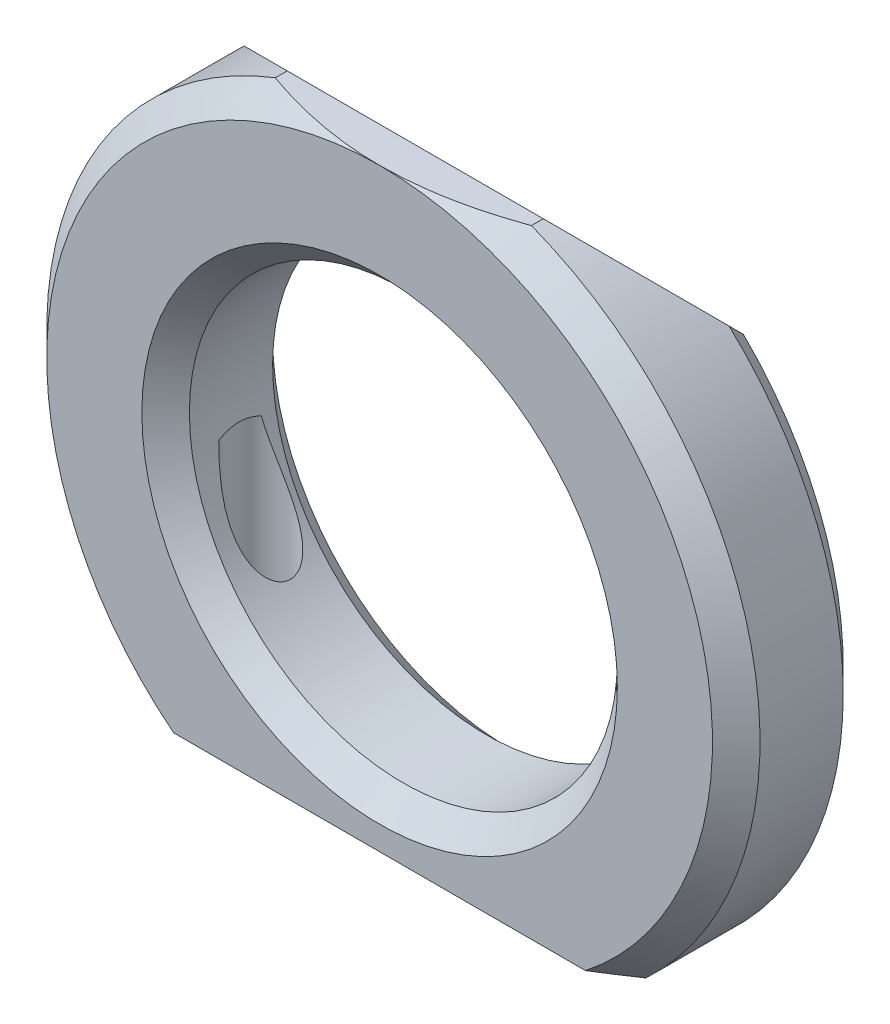
from build123d import *

# Parameters (mm, degrees)
SKETCH_1_R             = 7
SKETCH_1_R_2           = 5.5
EXTRUDE_1_DEPTH        = 30
EXTRUDE_START          = -7
SKETCH_2_R             = 15
SKETCH_2_R_2           = 5.5
EXTRUDE_2_DEPTH        = 7
SKETCH_5_W             = 5.5
SKETCH_5_H             = 9
CUT_EXTRUDE_4_DEPTH    = 15
HOLE_WIZARD_M3_1_D     = 2.5
HOLE_WIZARD_M3_1_DEPTH = 9.5
HOLE_WIZARD_M3_1_TIP   = 0.751075774
FILLET_1_R             = 1
SKETCH1_R              = 7.5
EXTRUDE1_DEPTH         = 5
CHAMFER1_SIZE          = 1
SKETCH_9_R             = 18
CUT_EXTRUDE_1_DEPTH    = 55
SKETCH_10_R            = 9
CUT_EXTRUDE_2_DEPTH    = 22.914607001
CHAMFER_5_SIZE         = 1
SKETCH_12_OUTSIDE_W    = 15.516
SKETCH_12_OUTSIDE_H    = 36.016
CUT_EXTRUDE_4_2_DEPTH  = 15


with BuildPart() as part:
    # 草图1 → 拉伸1 (new, symmetric)
    with BuildSketch(Plane.XY):
        Circle(SKETCH_1_R)
        Circle(SKETCH_1_R_2, mode=Mode.SUBTRACT)
    extrude(amount=EXTRUDE_1_DEPTH, both=True)

    # 草图2 → 拉伸2 (add)
    with BuildSketch(Plane.XY.offset(30).offset(EXTRUDE_START)):
        Circle(SKETCH_2_R)
        Circle(SKETCH_2_R_2, mode=Mode.SUBTRACT)
    extrude_2 = extrude(amount=EXTRUDE_2_DEPTH)

    # 镜向1: 拉伸2 across plane
    add(extrude_2.mirror(Plane.XY))

    # 草图5 → Cut-Extrude 4 (cut, symmetric)
    with BuildSketch(Plane(origin=(0, 0, 0), x_dir=(0, 0, -1), z_dir=(1, 0, 0))):
        with Locations((-27.25, -15.5)):
            Rectangle(SKETCH_5_W, SKETCH_5_H)
        with Locations((27.25, -15.5)):
            Rectangle(SKETCH_5_W, SKETCH_5_H)
    extrude(amount=CUT_EXTRUDE_4_DEPTH, both=True, mode=Mode.SUBTRACT)

    # M3 螺纹孔1
    with Locations(Plane(origin=(-8, -11, 27.5), x_dir=(0, 0, -1), z_dir=(0, -1, 0))):
        with Locations((0, 0), (0, 16), (55, 0), (55, 16)):
            Hole(HOLE_WIZARD_M3_1_D / 2, depth=HOLE_WIZARD_M3_1_DEPTH)
            with Locations((0, 0, -(HOLE_WIZARD_M3_1_DEPTH + HOLE_WIZARD_M3_1_TIP / 2))):  # 118° drill point
                Cone(0, HOLE_WIZARD_M3_1_D / 2, HOLE_WIZARD_M3_1_TIP, mode=Mode.SUBTRACT)

    # 圆角1
    fillet_1_edges = [part.edges().sort_by_distance(p)[0] for p in [
        (-7, 0, -23),
        (-7, 0, 23),
    ]]
    fillet(fillet_1_edges, radius=FILLET_1_R)

    # Sketch1 → Extrude1 (cut)
    with BuildSketch(Plane(origin=(0, 0, 30), x_dir=(-1, 0, 0), z_dir=(0, 0, -1))):
        Circle(SKETCH1_R)
    extrude(amount=EXTRUDE1_DEPTH, mode=Mode.SUBTRACT)

    # Chamfer1
    chamfer1_edges = [part.edges().sort_by_distance(p)[0] for p in [
        (-5.5, 0, 25),
    ]]
    chamfer(chamfer1_edges, length=CHAMFER1_SIZE)

    # 草图9 → 切除-拉伸1 (cut)
    with BuildSketch(Plane(origin=(0, 0, -24.5), x_dir=(-1, 0, 0), z_dir=(0, 0, -1))):
        Circle(SKETCH_9_R)
    extrude(amount=-CUT_EXTRUDE_1_DEPTH, mode=Mode.SUBTRACT)

    # 草图10 → 切除-拉伸2 (cut, through all)
    with BuildSketch(Plane(origin=(0, 0, -30), x_dir=(-1, 0, 0), z_dir=(0, 0, -1))):
        Circle(SKETCH_10_R)
    extrude(amount=-CUT_EXTRUDE_2_DEPTH, mode=Mode.SUBTRACT)

    # 倒角5
    chamfer_5_edges = [part.edges().sort_by_distance(p)[0] for p in [
        (9, 0, -24.5),
        (9, 0, -30),
        (0, 15, -30),
        (0, 15, -24.5),
    ]]
    chamfer(chamfer_5_edges, length=CHAMFER_5_SIZE)

    # 草图12 outside → Cut-Extrude 4 2 (cut, symmetric)
    with BuildSketch(Plane(origin=(0, 0, 0), x_dir=(0, 0, -1), z_dir=(1, 0, 0))):
        with Locations((27.25, 2)):
            Rectangle(SKETCH_12_OUTSIDE_W, SKETCH_12_OUTSIDE_H)
        Polygon((26, 14), (30, 10), (30, -11), (22, -11), (22, 14), align=None, mode=Mode.SUBTRACT)
    extrude(amount=CUT_EXTRUDE_4_2_DEPTH, both=True, mode=Mode.SUBTRACT)


solid = part.part
